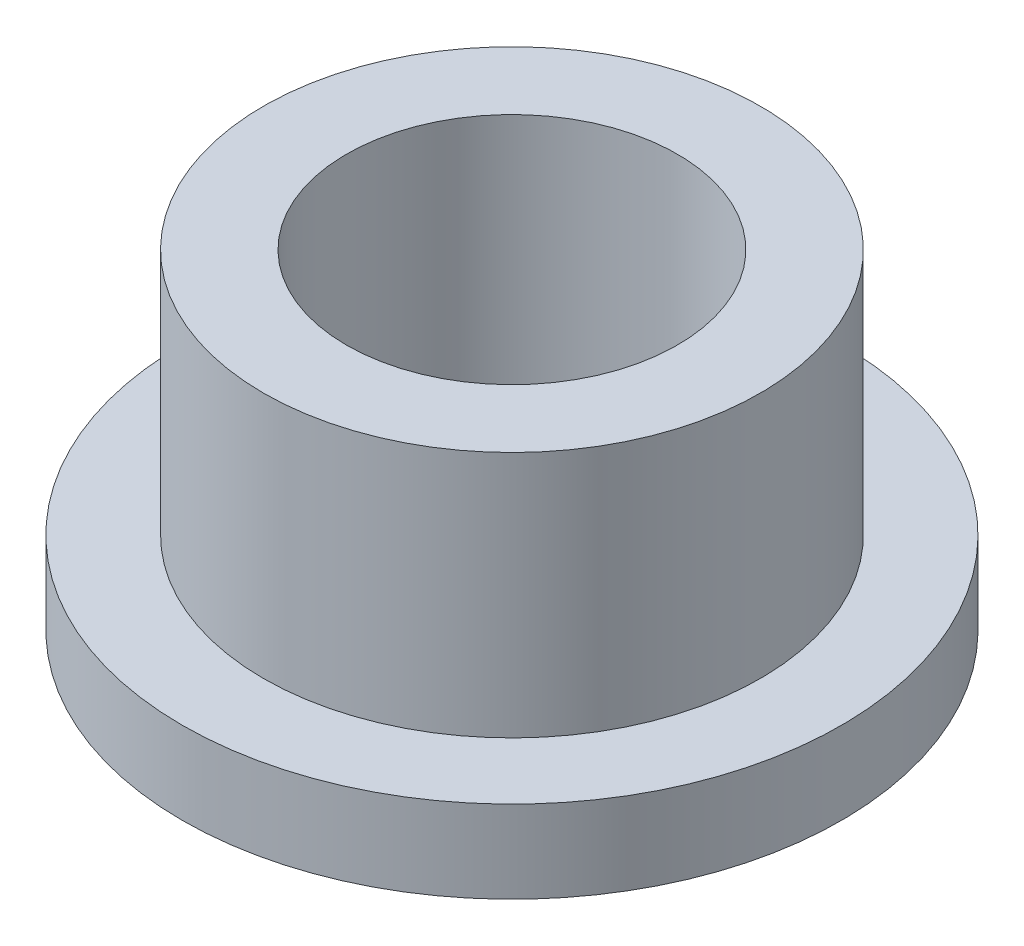
from build123d import *

# Parameters (mm, degrees)
SKETCH2_R           = 4.7879
SKETCH2_R_2         = 3.1877
BOSS_EXTRUDE1_DEPTH = 6.35
SKETCH3_R           = 6.35
SKETCH3_R_2         = 4.7879
BOSS_EXTRUDE2_DEPTH = 1.5875


with BuildPart() as part:
    # Sketch2 → Boss-Extrude1 (new body)
    with BuildSketch(Plane(origin=(0, 0, 0), x_dir=(1, 0, 0), z_dir=(0, 1, 0))):
        with Locations(Location((0, 0, 0), (0, 0, 270))):
            Circle(SKETCH2_R)
        with Locations(Location((0, 0, 0), (0, 0, 270))):
            Circle(SKETCH2_R_2, mode=Mode.SUBTRACT)
    extrude(amount=BOSS_EXTRUDE1_DEPTH)

    # Sketch3 → Boss-Extrude2 (add)
    with BuildSketch(Plane(origin=(0, 0, 0), x_dir=(1, 0, 0), z_dir=(0, 1, 0))):
        with Locations(Location((0, 0, 0), (0, 0, 270))):
            Circle(SKETCH3_R)
        with Locations(Location((0, 0, 0), (0, 0, 270))):
            Circle(SKETCH3_R_2, mode=Mode.SUBTRACT)
    extrude(amount=BOSS_EXTRUDE2_DEPTH)


solid = part.part
